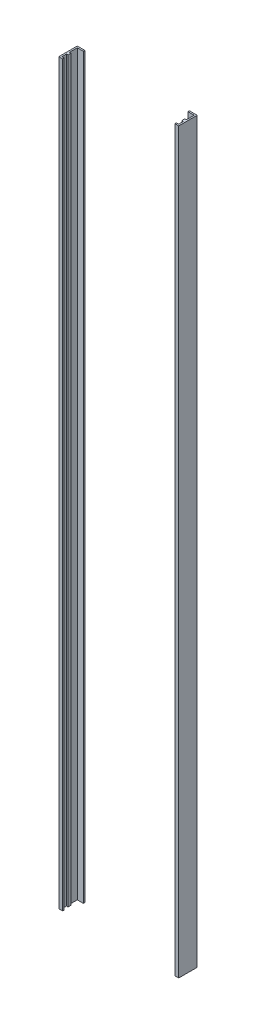
from build123d import *

# Parameters (mm, degrees)
BOSS_EXTRUDE1_DEPTH   = 1219.2
BOSS_EXTRUDE1_2_DEPTH = 1219.2


with BuildPart() as part:
    # Sketch1 → Boss-Extrude1 (new body)
    with BuildSketch(Plane(origin=(0, 0, 0), x_dir=(1, 0, 0), z_dir=(0, 1, 0))):
        Polygon((-99.06, 0), (-92.71, 0), (-92.71, 2.54), (-96.52, 2.54), (-96.52, 10.16), (-93.98, 10.16), (-93.98, 15.24), (-96.52, 15.24), (-96.52, 27.94), (-86.36, 27.94), (-86.36, 30.48), (-99.06, 30.48), align=None)
    extrude(amount=BOSS_EXTRUDE1_DEPTH)


with BuildPart() as body_2:
    # Sketch1 → Boss-Extrude1 2 (new body)
    with BuildSketch(Plane(origin=(0, 0, 0), x_dir=(1, 0, 0), z_dir=(0, 1, 0))):
        Polygon((96.52, 2.54), (92.71, 2.54), (92.71, 0), (99.06, 0), (99.06, 30.48), (86.36, 30.48), (86.36, 27.94), (96.52, 27.94), (96.52, 15.24), (93.98, 15.24), (93.98, 10.16), (96.52, 10.16), align=None)
    extrude(amount=BOSS_EXTRUDE1_2_DEPTH)


solid = Compound([part.part, body_2.part])
